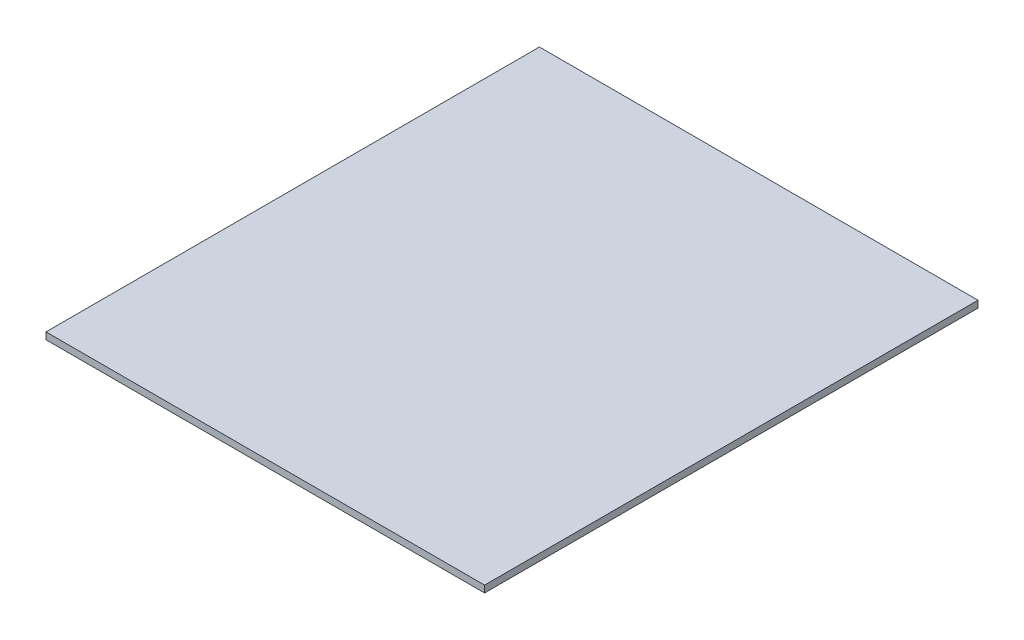
from build123d import *

# Parameters (mm, degrees)
SKETCH2_W           = 406.4
SKETCH2_H           = 457.2
BOSS_EXTRUDE1_DEPTH = 6.35


with BuildPart() as part:
    # Sketch2 → Boss-Extrude1 (new body)
    with BuildSketch(Plane(origin=(0, 0, 0), x_dir=(1, 0, 0), z_dir=(0, 1, 0))):
        Rectangle(SKETCH2_W, SKETCH2_H)
    extrude(amount=BOSS_EXTRUDE1_DEPTH)


solid = part.part
